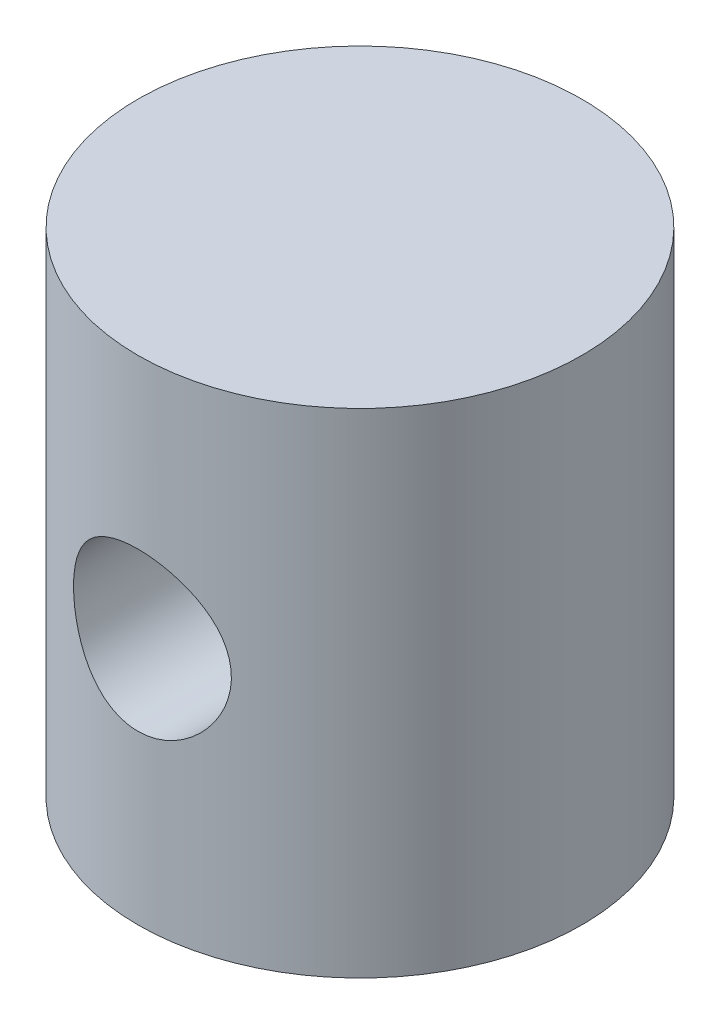
from build123d import *

# Parameters (mm, degrees)
SKETCH3_R           = 4.5
BOSS_EXTRUDE1_DEPTH = 10
SKETCH4_R           = 1.6
CUT_EXTRUDE1_DEPTH  = 10
CUT_EXTRUDE2_START  = 49
SKETCH9_R           = 1.6
CUT_EXTRUDE2_DEPTH  = 49


with BuildPart() as part:
    # Sketch3 → Boss-Extrude1 (new body)
    with BuildSketch(Plane(origin=(0, 0, 0), x_dir=(1, 0, 0), z_dir=(0, 1, 0))):
        with Locations(Location((0, 0, 0), (0, 0, 270))):
            Circle(SKETCH3_R)
    extrude(amount=BOSS_EXTRUDE1_DEPTH)

    # Sketch4 → Cut-Extrude1 (cut)
    with BuildSketch(Plane.XY):
        with Locations((0, 5)):
            Circle(SKETCH4_R)
    extrude(amount=-CUT_EXTRUDE1_DEPTH, mode=Mode.SUBTRACT)

    # Sketch9 → Cut-Extrude2 (cut)
    with BuildSketch(Plane.XY.offset(CUT_EXTRUDE2_START)):
        with Locations(Location((0, 5, 0), (0, 0, 90))):
            Circle(SKETCH9_R)
    extrude(amount=-CUT_EXTRUDE2_DEPTH, mode=Mode.SUBTRACT)


solid = part.part
